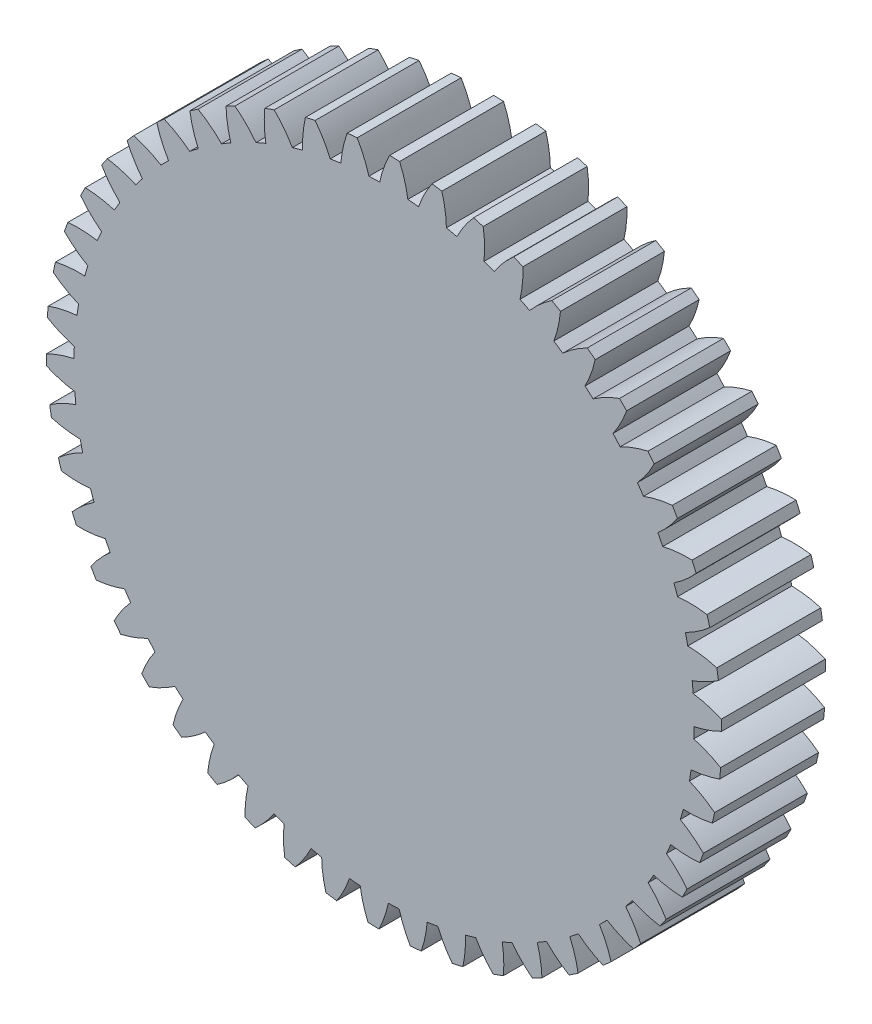
from build123d import *

# Parameters (mm, degrees)
SKETCH1_R           = 104
BOSS_EXTRUDE1_DEPTH = 32.017696821
CUT_EXTRUDE1_DEPTH  = 151.522865073
CIRPATTERN1_COUNT   = 50


with BuildPart() as part:
    # Sketch1 → Boss-Extrude1 (new body)
    with BuildSketch(Plane.XY):
        Circle(SKETCH1_R)
    extrude(amount=BOSS_EXTRUDE1_DEPTH)

    # Sketch2 → Cut-Extrude1 (cut, through all)
    with BuildSketch(Plane.XY.offset(32.017696821)):
        with BuildLine():
            ThreePointArc((1.745022429, 103.98535905), (-3.266860891, 103.948677817), (-8.271156878, 103.670574243))
            ThreePointArc((-8.271156878, 103.670574243), (-6.177228303, 99.566552247), (-4.653893707, 95.21833593))
            ThreePointArc((-4.653893707, 95.21833593), (-2.9945806, 95.284955324), (-1.334358806, 95.322661055))
            ThreePointArc((-1.334358806, 95.322661055), (-0.087069037, 99.757951537), (1.745022429, 103.98535905))
        make_face()
    cut_extrude1 = extrude(amount=-CUT_EXTRUDE1_DEPTH, mode=Mode.SUBTRACT)

    # CirPattern1: Cut-Extrude1 ×50 about axis
    cirpattern1_axis = Axis((0.005028693, -0.16000863, 0), (0, 0, 1))
    for i in range(1, CIRPATTERN1_COUNT):
        add(cut_extrude1.rotate(cirpattern1_axis, i * 360 / CIRPATTERN1_COUNT), mode=Mode.SUBTRACT)


solid = part.part
